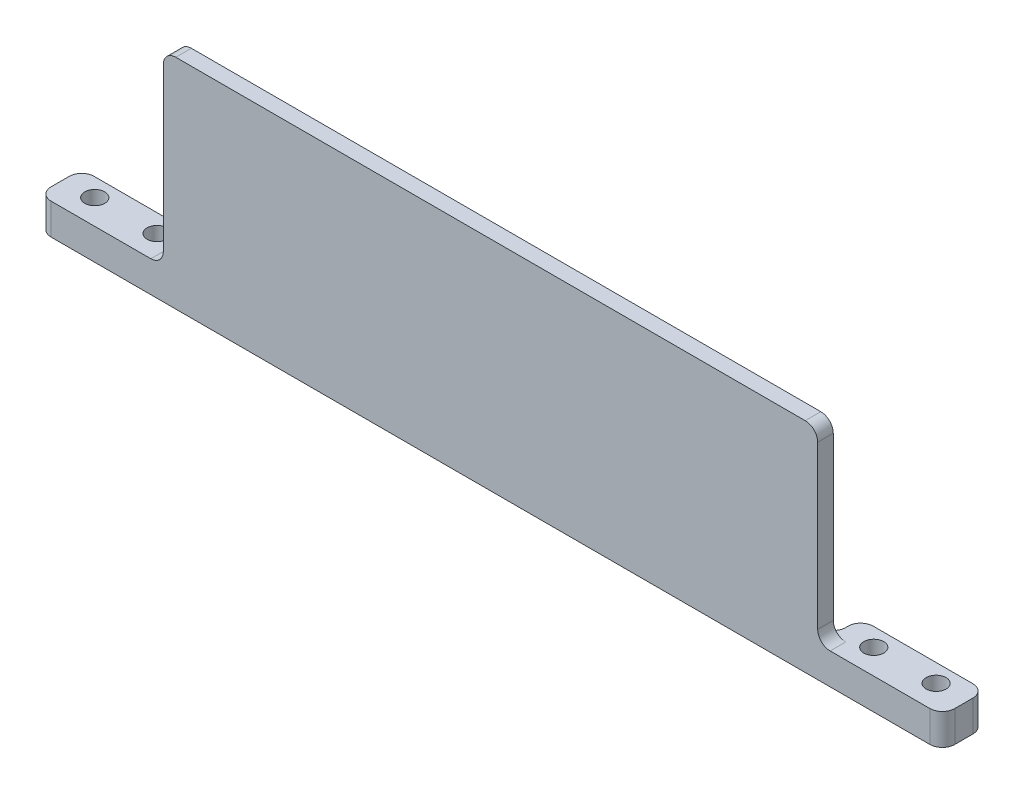
from build123d import *

# Parameters (mm, degrees)
SKETCH_1_R      = 1.6
EXTRUDE_1_DEPTH = 5
SKETCH_2_W      = 105
SKETCH_2_H      = 2.5
EXTRUDE_2_DEPTH = 30
FILLET_4_R      = 2
FILLET_5_R      = 2


with BuildPart() as part:
    # 草图1 → 凸台-拉伸1 (new body)
    with BuildSketch(Plane(origin=(0, 0, 0), x_dir=(1, 0, 0), z_dir=(0, 1, 0))):
        Polygon((72.5, -4), (-72.5, -4), (-72.5, 2.9), (-52.5, 2.9), (-52.5, -1.5), (52.5, -1.5), (52.5, 2.9), (72.5, 2.9), align=None)
        with Locations(Location((-67.5, 0, 0), (0, 0, 270))):
            Circle(SKETCH_1_R, mode=Mode.SUBTRACT)
        with Locations(Location((-57.5, 0, 0), (0, 0, 270))):
            Circle(SKETCH_1_R, mode=Mode.SUBTRACT)
        with Locations(Location((67.5, 0, 0), (0, 0, 90))):
            Circle(SKETCH_1_R, mode=Mode.SUBTRACT)
        with Locations(Location((57.5, 0, 0), (0, 0, 90))):
            Circle(SKETCH_1_R, mode=Mode.SUBTRACT)
    extrude(amount=EXTRUDE_1_DEPTH)

    # 草图2 → 凸台-拉伸2 (add)
    with BuildSketch(Plane(origin=(0, 5, 0), x_dir=(1, 0, 0), z_dir=(0, 1, 0))):
        with Locations((0, -2.75)):
            Rectangle(SKETCH_2_W, SKETCH_2_H)
    extrude(amount=EXTRUDE_2_DEPTH)

    # 圆角4
    fillet_4_edges = [part.edges().sort_by_distance(p)[0] for p in [
        (72.5, 2.5, 4),
        (-72.5, 2.5, 4),
        (72.5, 2.5, -2.9),
        (-72.5, 2.5, -2.9),
        (52.5, 2.5, -2.9),
        (-52.5, 2.5, -2.9),
        (-52.5, 2.5, 1.5),
        (52.5, 2.5, 1.5),
        (52.5, 35, 2.75),
        (-52.5, 35, 2.75),
    ]]
    fillet(fillet_4_edges, radius=FILLET_4_R)

    # 圆角5
    fillet_5_edges = [part.edges().sort_by_distance(p)[0] for p in [
        (-52.5, 5, 2.75),
        (52.5, 5, 2.75),
    ]]
    fillet(fillet_5_edges, radius=FILLET_5_R)


solid = part.part
